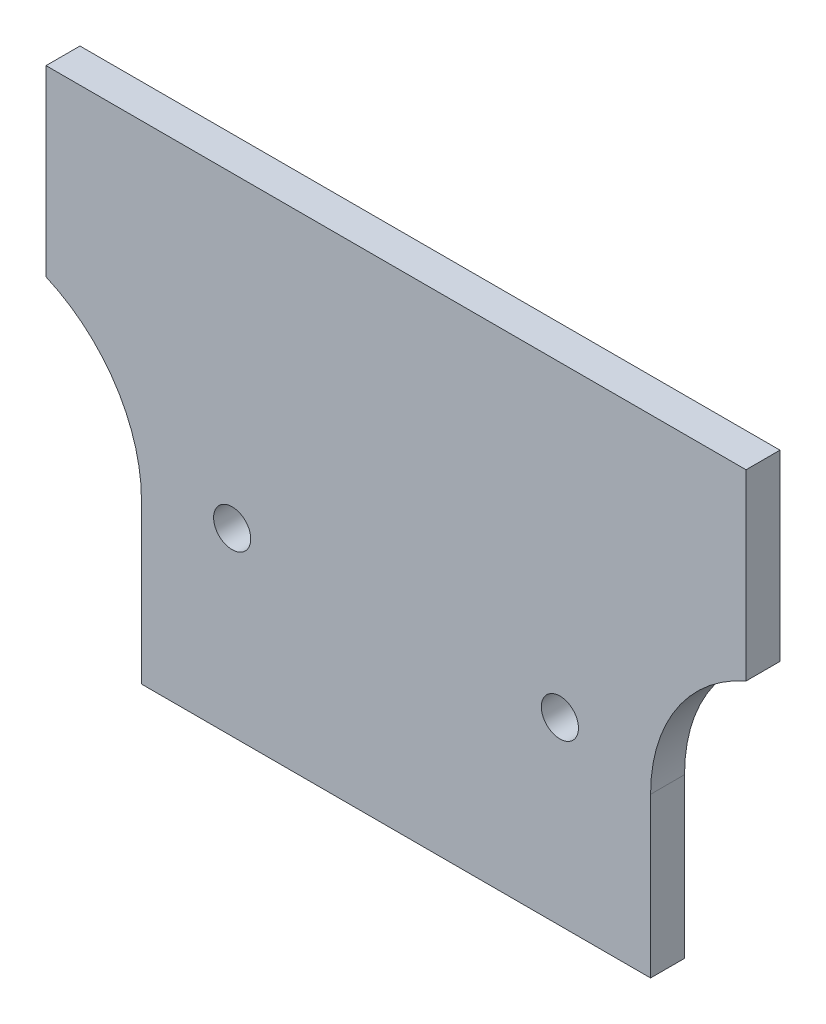
from build123d import *

# Parameters (mm, degrees)
SKETCH2_W           = 11.43
SKETCH2_H           = 8.89
SKETCH2_R           = 0.445
BOSS_EXTRUDE1_DEPTH = 0.8128
SKETCH4_R           = 0.445
BOSS_EXTRUDE2_DEPTH = 0.8128


with BuildPart() as part:
    # Sketch2 → Boss-Extrude1 (new body)
    with BuildSketch(Plane.XY):
        with Locations((0, 0.635)):
            Rectangle(SKETCH2_W, SKETCH2_H)
        with Locations((-3.9243, 0.508)):
            Circle(SKETCH2_R, mode=Mode.SUBTRACT)
        with Locations((3.9243, 0.508)):
            Circle(SKETCH2_R, mode=Mode.SUBTRACT)
    extrude(amount=BOSS_EXTRUDE1_DEPTH)

    # Sketch4 → Boss-Extrude2 (add)
    with BuildSketch(Plane.XY):
        with BuildLine():
            Line((8.382, 7.874), (-8.382, 7.874))
            Line((-8.382, 7.874), (-8.382, 3.49192268))
            ThreePointArc((-8.382, 3.49192268), (-6.718325299, 2.086822944), (-6.096, 0))
            Line((-6.096, 0), (-6.096, -3.81))
            Line((-6.096, -3.81), (6.096, -3.81))
            Line((6.096, -3.81), (6.096, 0))
            ThreePointArc((6.096, 0), (6.718325299, 2.086822944), (8.382, 3.49192268))
            Line((8.382, 3.49192268), (8.382, 7.874))
        make_face()
        with Locations((-3.9243, 0.508)):
            Circle(SKETCH4_R, mode=Mode.SUBTRACT)
        with Locations((3.9243, 0.508)):
            Circle(SKETCH4_R, mode=Mode.SUBTRACT)
    extrude(amount=BOSS_EXTRUDE2_DEPTH)


solid = part.part
